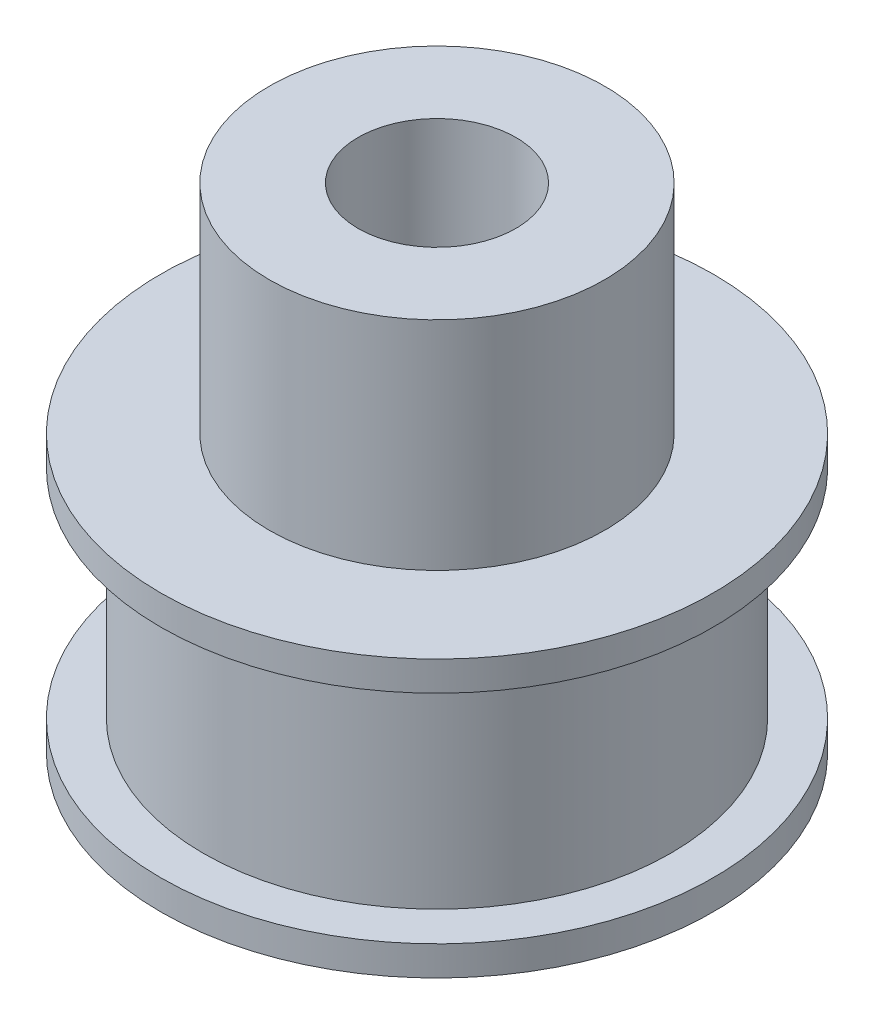
from build123d import *

# Parameters (mm, degrees)
SKETCH1_R           = 14
BOSS_EXTRUDE1_DEPTH = 1.5
SKETCH2_R           = 11.85
BOSS_EXTRUDE2_DEPTH = 11
SKETCH3_R           = 14
BOSS_EXTRUDE3_DEPTH = 1.5
SKETCH4_R           = 8.5
BOSS_EXTRUDE4_DEPTH = 11
SKETCH5_R           = 4
CUT_EXTRUDE1_DEPTH  = 32.890437438


with BuildPart() as part:
    # Sketch1 → Boss-Extrude1 (new body)
    with BuildSketch(Plane(origin=(0, 0, 0), x_dir=(1, 0, 0), z_dir=(0, 1, 0))):
        with Locations(Location((0, 0, 0), (0, 0, 270))):
            Circle(SKETCH1_R)
    extrude(amount=BOSS_EXTRUDE1_DEPTH)

    # Sketch2 → Boss-Extrude2 (add)
    with BuildSketch(Plane(origin=(0, 1.5, 0), x_dir=(1, 0, 0), z_dir=(0, 1, 0))):
        with Locations(Location((0, 0, 0), (0, 0, 270))):
            Circle(SKETCH2_R)
    extrude(amount=BOSS_EXTRUDE2_DEPTH)

    # Sketch3 → Boss-Extrude3 (add)
    with BuildSketch(Plane(origin=(0, 12.5, 0), x_dir=(1, 0, 0), z_dir=(0, 1, 0))):
        with Locations(Location((0, 0, 0), (0, 0, 270))):
            Circle(SKETCH3_R)
    extrude(amount=BOSS_EXTRUDE3_DEPTH)

    # Sketch4 → Boss-Extrude4 (add)
    with BuildSketch(Plane(origin=(0, 14, 0), x_dir=(1, 0, 0), z_dir=(0, 1, 0))):
        with Locations(Location((0, 0, 0), (0, 0, 270))):
            Circle(SKETCH4_R)
    extrude(amount=BOSS_EXTRUDE4_DEPTH)

    # Sketch5 → Cut-Extrude1 (cut, through all)
    with BuildSketch(Plane(origin=(0, 25, 0), x_dir=(1, 0, 0), z_dir=(0, 1, 0))):
        with Locations(Location((0, 0, 0), (0, 0, 270))):
            Circle(SKETCH5_R)
    extrude(amount=-CUT_EXTRUDE1_DEPTH, mode=Mode.SUBTRACT)


solid = part.part
